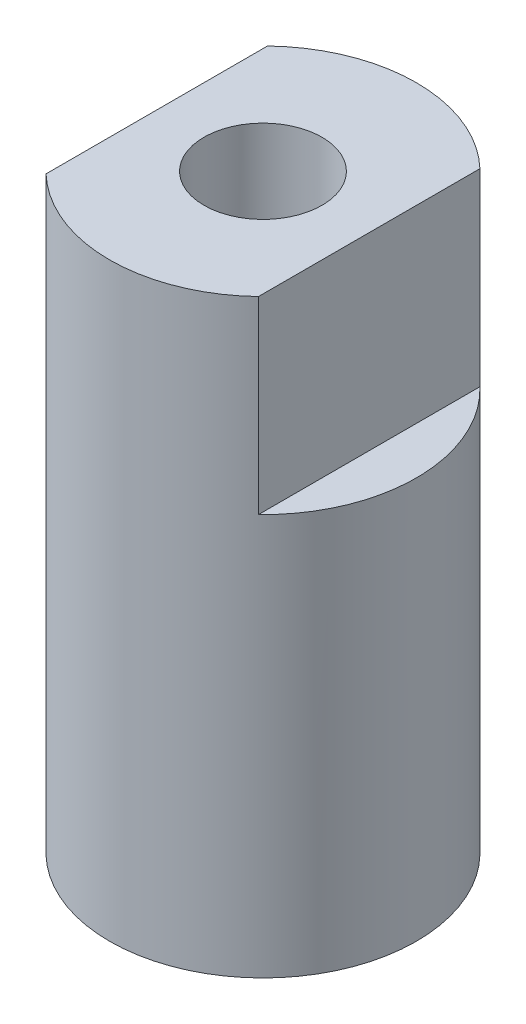
from build123d import *

# Parameters (mm, degrees)
SKETCH1_R                 = 2.6
BOSS_EXTRUDE1_DEPTH       = 10
CUT_EXTRUDE1_START        = -3.2
CUT_EXTRUDE1_DEPTH        = 3.2
F_1_0MM_DOWEL_HOLE1_D     = 2
F_1_0MM_DOWEL_HOLE1_DEPTH = 3.399139381
F_1_0MM_DOWEL_HOLE1_TIP   = 0.600860619
SKETCH5_R                 = 1.55
CUT_EXTRUDE2_DEPTH        = 8


with BuildPart() as part:
    # Sketch1 → Boss-Extrude1 (new body)
    with BuildSketch(Plane(origin=(0, 0, 0), x_dir=(1, 0, 0), z_dir=(0, 1, 0))):
        Circle(SKETCH1_R)
    extrude(amount=BOSS_EXTRUDE1_DEPTH)

    # Sketch2 → Cut-Extrude1 (cut)
    with BuildSketch(Plane(origin=(0, 10, 0), x_dir=(1, 0, 0), z_dir=(0, 1, 0)).offset(CUT_EXTRUDE1_START)):
        with BuildLine():
            Line((-1.8, 1.876166304), (-1.8, -1.876166304))
            ThreePointArc((-1.8, -1.876166304), (-2.6, 0), (-1.8, 1.876166304))
        make_face()
        with BuildLine():
            Line((1.8, 1.876166304), (1.8, -1.876166304))
            ThreePointArc((1.8, -1.876166304), (2.6, 0), (1.8, 1.876166304))
        make_face()
    extrude(amount=CUT_EXTRUDE1_DEPTH, mode=Mode.SUBTRACT)

    # Ø1.0mm Dowel Hole1
    with Locations(Plane(origin=(0, 10, 0), x_dir=(1, 0, 0), z_dir=(0, 1, 0))):
        with Locations((0, 0)):
            Hole(F_1_0MM_DOWEL_HOLE1_D / 2, depth=F_1_0MM_DOWEL_HOLE1_DEPTH)
            with Locations((0, 0, -(F_1_0MM_DOWEL_HOLE1_DEPTH + F_1_0MM_DOWEL_HOLE1_TIP / 2))):  # 118° drill point
                Cone(0, F_1_0MM_DOWEL_HOLE1_D / 2, F_1_0MM_DOWEL_HOLE1_TIP, mode=Mode.SUBTRACT)

    # Sketch5 → Cut-Extrude2 (cut)
    with BuildSketch(Plane.XZ):
        Circle(SKETCH5_R)
    extrude(amount=-CUT_EXTRUDE2_DEPTH, mode=Mode.SUBTRACT)


solid = part.part
